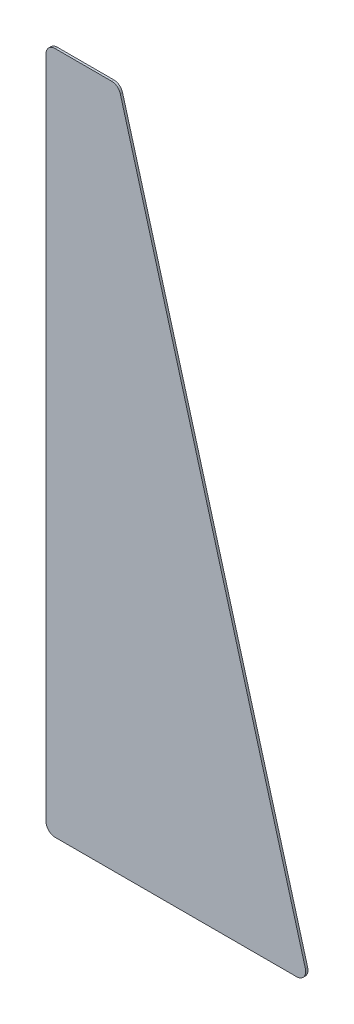
from build123d import *

# Parameters (mm, degrees)
BOSS_EXTRUDE1_DEPTH = 1.5875
FILLET1_R           = 6.35


with BuildPart() as part:
    # Sketch2 → Boss-Extrude1 (new body)
    with BuildSketch(Plane.XY):
        Polygon((0, 0), (0, 479.171), (50.8, 479.171), (184.15, 0), align=None)
    extrude(amount=BOSS_EXTRUDE1_DEPTH)

    # Fillet1
    fillet1_edges = [part.edges().sort_by_distance(p)[0] for p in [
        (0, 0, 0.79375),
        (0, 479.171, 0.79375),
        (50.8, 479.171, 0.79375),
        (184.15, 0, 0.79375),
    ]]
    fillet(fillet1_edges, radius=FILLET1_R)


solid = part.part
